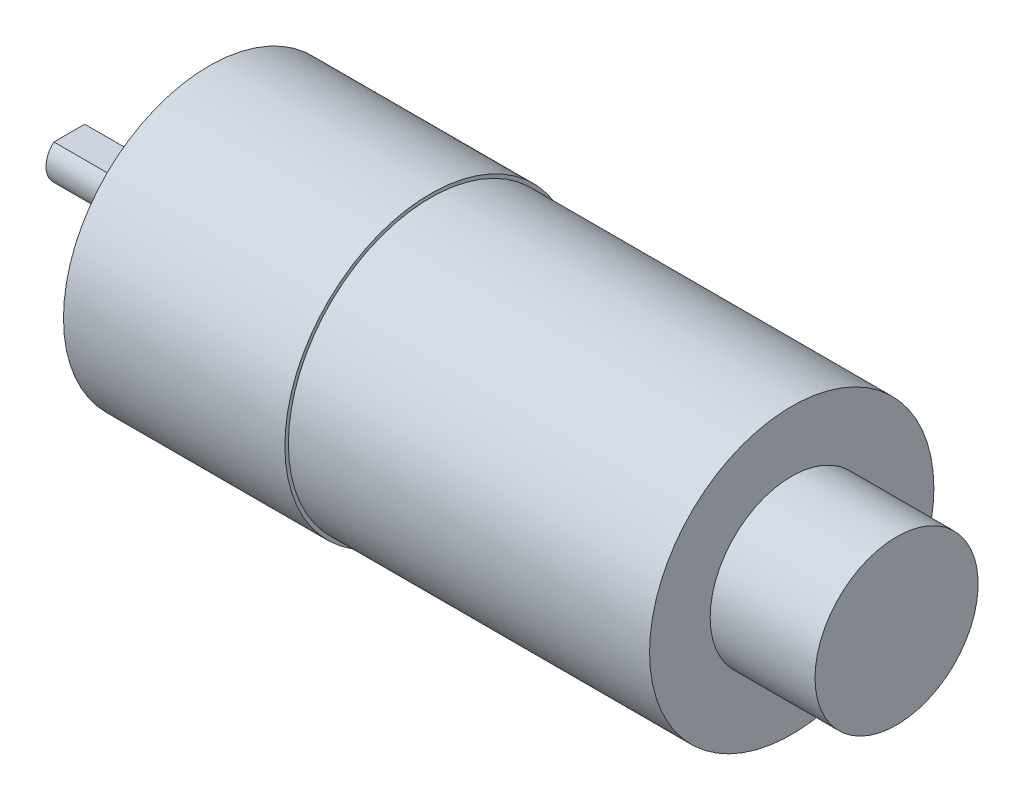
from build123d import *

# Parameters (mm, degrees)
SKETCH1_W          = 9.5
SKETCH1_H          = 2
SKETCH1_W_2        = 9
SKETCH1_H_2        = 7
SKETCH2_W          = 4
SKETCH2_H          = 0.5
CUT_EXTRUDE1_DEPTH = 8
SKETCH3_R          = 1.25
CUT_EXTRUDE2_DEPTH = 8


with BuildPart() as part:
    # Sketch1 → Revolve1 (revolve)
    with BuildSketch(Plane.XY, mode=Mode.PRIVATE) as revolve1_sk:
        with Locations((-4.75, 1)):
            Rectangle(SKETCH1_W, SKETCH1_H)
        Polygon((0, 2), (0, 0), (21.5, 0), (21.5, 12.2), (21.5, 12.5), (2.5, 12.5), (2.5, 3.5), (0, 3.5), align=None)
        Polygon((21.5, 12.2), (21.5, 0), (52.5, 0), (52.5, 7), (52.5, 12.2), align=None)
        with Locations((57, 3.5)):
            Rectangle(SKETCH1_W_2, SKETCH1_H_2)
    revolve(revolve1_sk.sketch.rotate(Axis((0, 0, 0), (1, 0, 0)), 90), axis=Axis((0, 0, 0), (1, 0, 0)))

    # Sketch2 → Cut-Extrude1 (cut)
    with BuildSketch(Plane.ZY.offset(9.5)):
        with Locations((0, 1.75)):
            Rectangle(SKETCH2_W, SKETCH2_H)
    extrude(amount=-CUT_EXTRUDE1_DEPTH, mode=Mode.SUBTRACT)

    # Sketch3 → Cut-Extrude2 (cut)
    with BuildSketch(Plane.ZY.offset(-2.5)):
        with Locations((0, 8.5)):
            Circle(SKETCH3_R)
        with Locations(Location((0, -8.5, 0), (0, 0, 180))):
            Circle(SKETCH3_R)
    extrude(amount=-CUT_EXTRUDE2_DEPTH, mode=Mode.SUBTRACT)


solid = part.part
